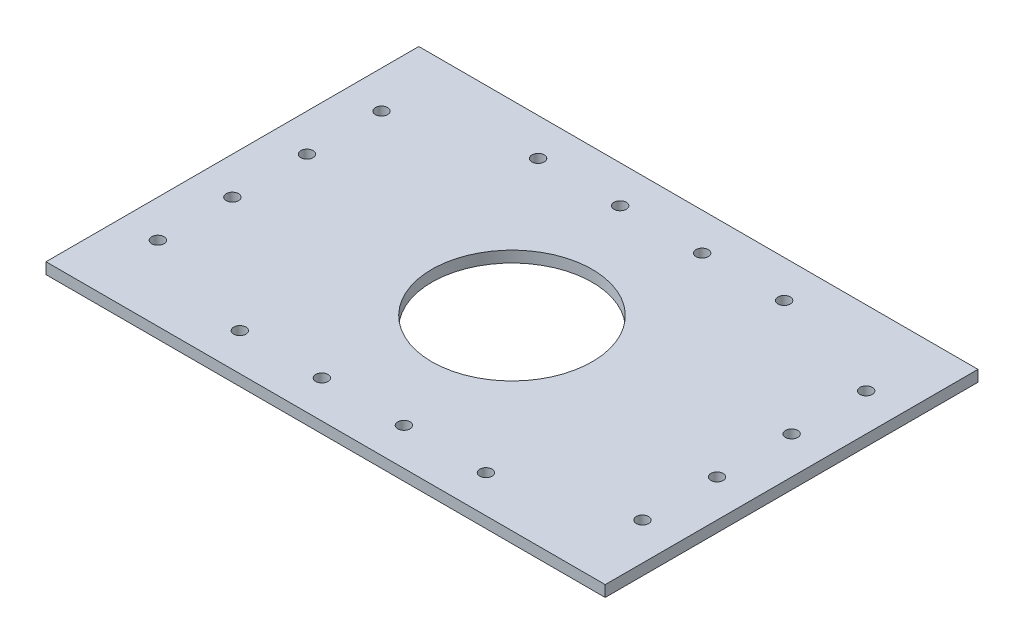
from build123d import *

# Parameters (mm, degrees)
SKETCH_1_W      = 150
SKETCH_1_H      = 100
SKETCH_1_R      = 21.5
SKETCH_1_R_2    = 1.65
EXTRUDE_1_DEPTH = 3


with BuildPart() as part:
    # 草图1 → 凸台-拉伸1 (new body)
    with BuildSketch(Plane(origin=(0, 0, 0), x_dir=(1, 0, 0), z_dir=(0, 1, 0))):
        Rectangle(SKETCH_1_W, SKETCH_1_H)
        with Locations(Location((0, 0, 0), (0, 0, 270))):
            Circle(SKETCH_1_R, mode=Mode.SUBTRACT)
        with Locations(Location((-65, 30, 0), (0, 0, 270))):
            Circle(SKETCH_1_R_2, mode=Mode.SUBTRACT)
        with Locations(Location((-65, 10, 0), (0, 0, 270))):
            Circle(SKETCH_1_R_2, mode=Mode.SUBTRACT)
        with Locations(Location((-65, -10, 0), (0, 0, 270))):
            Circle(SKETCH_1_R_2, mode=Mode.SUBTRACT)
        with Locations(Location((-65, -30, 0), (0, 0, 270))):
            Circle(SKETCH_1_R_2, mode=Mode.SUBTRACT)
        with Locations(Location((65, -30, 0), (0, 0, 90))):
            Circle(SKETCH_1_R_2, mode=Mode.SUBTRACT)
        with Locations(Location((65, -10, 0), (0, 0, 90))):
            Circle(SKETCH_1_R_2, mode=Mode.SUBTRACT)
        with Locations(Location((65, 10, 0), (0, 0, 90))):
            Circle(SKETCH_1_R_2, mode=Mode.SUBTRACT)
        with Locations(Location((65, 30, 0), (0, 0, 90))):
            Circle(SKETCH_1_R_2, mode=Mode.SUBTRACT)
        with Locations(Location((33, 40, 0), (0, 0, 270))):
            Circle(SKETCH_1_R_2, mode=Mode.SUBTRACT)
        with Locations(Location((11, 40, 0), (0, 0, 270))):
            Circle(SKETCH_1_R_2, mode=Mode.SUBTRACT)
        with Locations(Location((-11, 40, 0), (0, 0, 270))):
            Circle(SKETCH_1_R_2, mode=Mode.SUBTRACT)
        with Locations(Location((-33, 40, 0), (0, 0, 270))):
            Circle(SKETCH_1_R_2, mode=Mode.SUBTRACT)
        with Locations(Location((33, -40, 0), (0, 0, 90))):
            Circle(SKETCH_1_R_2, mode=Mode.SUBTRACT)
        with Locations(Location((11, -40, 0), (0, 0, 90))):
            Circle(SKETCH_1_R_2, mode=Mode.SUBTRACT)
        with Locations(Location((-11, -40, 0), (0, 0, 90))):
            Circle(SKETCH_1_R_2, mode=Mode.SUBTRACT)
        with Locations(Location((-33, -40, 0), (0, 0, 90))):
            Circle(SKETCH_1_R_2, mode=Mode.SUBTRACT)
    extrude(amount=EXTRUDE_1_DEPTH)


solid = part.part
